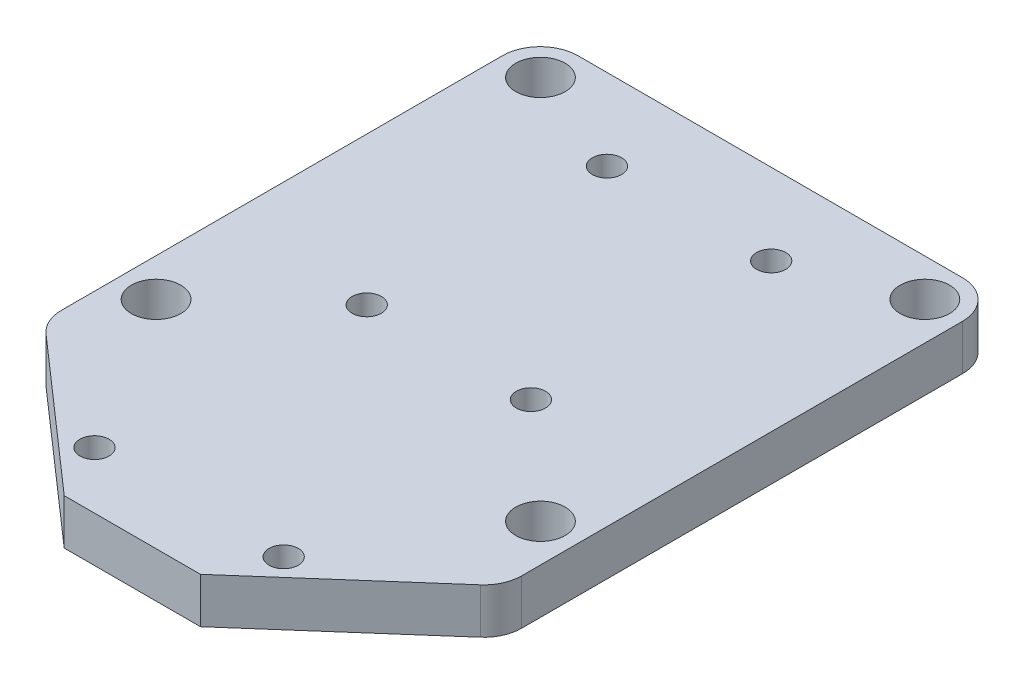
from build123d import *

# Parameters (mm, degrees)
BOSS_EXTRUDE1_DEPTH         = 6
FILLET1_R                   = 5
F_24_0_152_DIAMETER_HOLE1_D = 3.8608
F_0_257_DIAMETER_HOLE1_D    = 6.5278


with BuildPart() as part:
    # Sketch1 → Boss-Extrude1 (new body)
    with BuildSketch(Plane(origin=(0, 0, 0), x_dir=(1, 0, 0), z_dir=(0, 1, 0))):
        Polygon((-9, -42.15), (-30.4, -23.364405734), (-30.4, 42.15), (30.4, 42.15), (30.4, -23.364405734), (9, -42.15), align=None)
    extrude(amount=BOSS_EXTRUDE1_DEPTH)

    # Fillet1
    fillet1_edges = [part.edges().sort_by_distance(p)[0] for p in [
        (-30.4, 3, -42.15),
        (30.4, 3, -42.15),
        (30.4, 3, 23.364405734),
        (-30.4, 3, 23.364405734),
    ]]
    fillet(fillet1_edges, radius=FILLET1_R)

    # #24 (0.152) Diameter Hole1 (through all)
    with Locations(Plane(origin=(0, 6, 0), x_dir=(1, 0, 0), z_dir=(0, 1, 0))):
        with Locations((10.85, -0.325), (-10.85, -0.325), (-10.85, 31.425), (10.85, 31.425), (12.5, -34.65), (-12.5, -34.65)):
            Hole(F_24_0_152_DIAMETER_HOLE1_D / 2)

    # F (0.257) Diameter Hole1 (through all)
    with Locations(Plane(origin=(0, 6, 0), x_dir=(1, 0, 0), z_dir=(0, 1, 0))):
        with Locations((25.4, 37.185), (-25.4, 37.185), (-25.4, -13.615), (25.4, -13.615)):
            Hole(F_0_257_DIAMETER_HOLE1_D / 2)


solid = part.part
